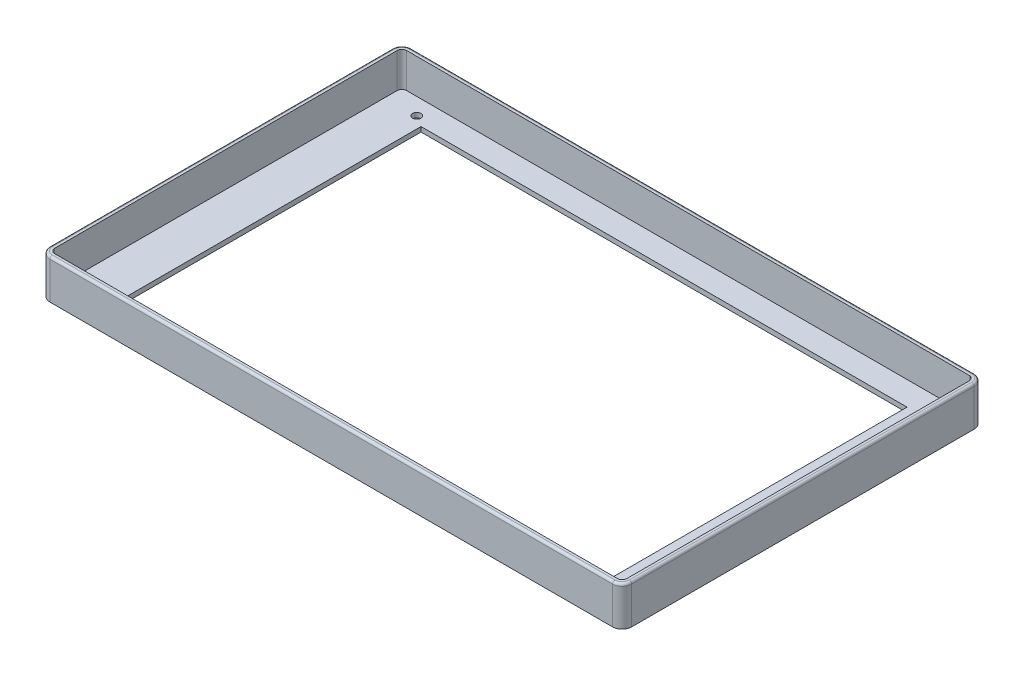
from build123d import *

# Parameters (mm, degrees)
SKIZZE1_W                       = 243
SKIZZE1_H                       = 151
SKIZZE1_W_2                     = 203
SKIZZE1_H_2                     = 125
AUFSATZ_LINEAR_AUSTRAGEN1_DEPTH = 2
SKIZZE2_W                       = 243
SKIZZE2_H                       = 151
SKIZZE2_W_2                     = 239
SKIZZE2_H_2                     = 147
AUFSATZ_LINEAR_AUSTRAGEN2_DEPTH = 14.5
SKIZZE3_R                       = 1.75
SCHNITT_LINEAR_AUSTRAGEN1_DEPTH = 287.461603012
VERRUNDUNG1_R                   = 2
VERRUNDUNG2_R                   = 4
VERRUNDUNG3_R                   = 1


with BuildPart() as part:
    # Skizze1 → Aufsatz-Linear austragen1 (new body)
    with BuildSketch(Plane(origin=(0, 0, 0), x_dir=(1, 0, 0), z_dir=(0, 1, 0))):
        with Locations((121.5, 75.5)):
            Rectangle(SKIZZE1_W, SKIZZE1_H)
        with Locations((121.5, 76.5)):
            Rectangle(SKIZZE1_W_2, SKIZZE1_H_2, mode=Mode.SUBTRACT)
    extrude(amount=AUFSATZ_LINEAR_AUSTRAGEN1_DEPTH)

    # Skizze2 → Aufsatz-Linear austragen2 (add)
    with BuildSketch(Plane(origin=(0, 2, 0), x_dir=(1, 0, 0), z_dir=(0, 1, 0))):
        with Locations((121.5, 75.5)):
            Rectangle(SKIZZE2_W, SKIZZE2_H)
        with Locations((121.5, 75.5)):
            Rectangle(SKIZZE2_W_2, SKIZZE2_H_2, mode=Mode.SUBTRACT)
    extrude(amount=AUFSATZ_LINEAR_AUSTRAGEN2_DEPTH)

    # Skizze3 → Schnitt-Linear austragen1 (cut, through all)
    with BuildSketch(Plane(origin=(0, 2, 0), x_dir=(1, 0, 0), z_dir=(0, 1, 0))):
        with Locations(Location((15.23, 142, 0), (0, 0, 270))):
            Circle(SKIZZE3_R)
        with Locations(Location((233.33, 142, 0), (0, 0, 270))):
            Circle(SKIZZE3_R)
        with Locations(Location((15.23, 9, 0), (0, 0, 270))):
            Circle(SKIZZE3_R)
        with Locations(Location((233.33, 9, 0), (0, 0, 270))):
            Circle(SKIZZE3_R)
    extrude(amount=-SCHNITT_LINEAR_AUSTRAGEN1_DEPTH, mode=Mode.SUBTRACT)

    # Verrundung1
    verrundung1_edges = [part.edges().sort_by_distance(p)[0] for p in [
        (2, 9.25, -2),
        (241, 9.25, -2),
        (241, 9.25, -149),
        (2, 9.25, -149),
    ]]
    fillet(verrundung1_edges, radius=VERRUNDUNG1_R)

    # Verrundung2
    verrundung2_edges = [part.edges().sort_by_distance(p)[0] for p in [
        (0, 8.25, -151),
        (243, 8.25, -151),
        (243, 8.25, 0),
        (0, 8.25, 0),
    ]]
    fillet(verrundung2_edges, radius=VERRUNDUNG2_R)

    # Verrundung3
    verrundung3_edges = [part.edges().sort_by_distance(p)[0] for p in [
        (121.5, 16.5, -151),
        (121.5, 16.5, 0),
        (243, 16.5, -75.5),
        (1.171572875, 16.5, -1.171572875),
        (241.828427125, 16.5, -1.171572875),
        (241.828427125, 16.5, -149.828427125),
        (1.171572875, 16.5, -149.828427125),
        (0, 16.5, -75.5),
    ]]
    fillet(verrundung3_edges, radius=VERRUNDUNG3_R)


solid = part.part
